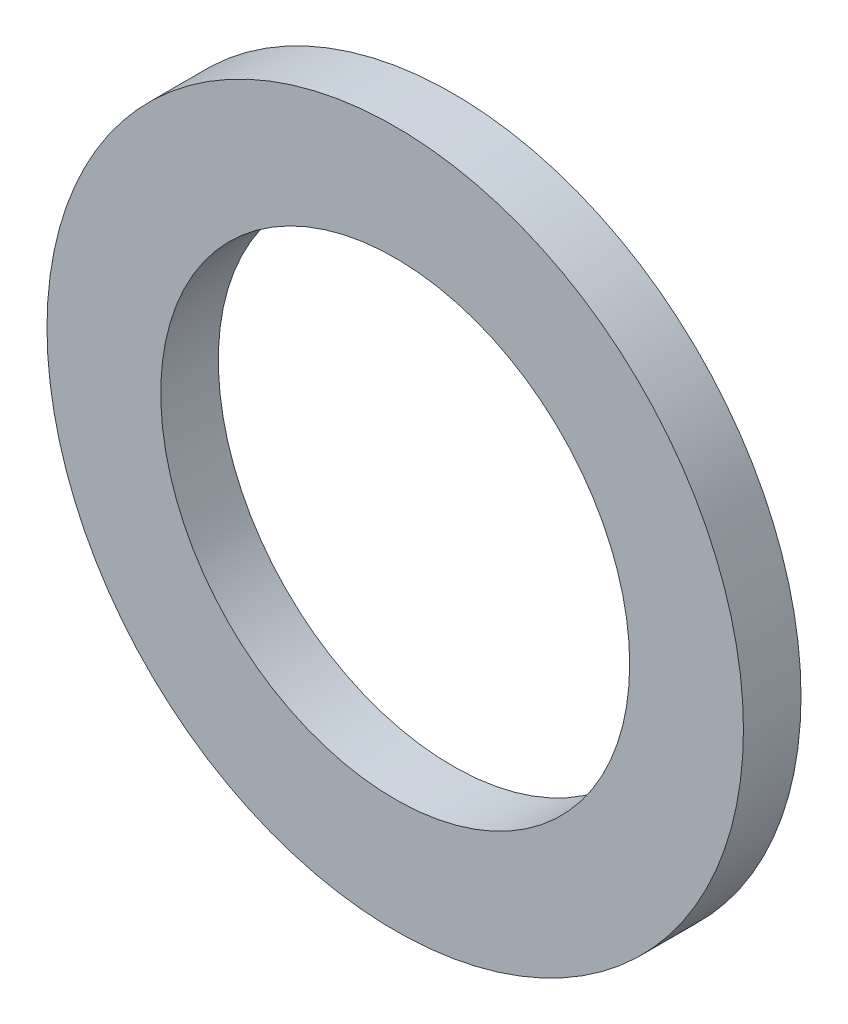
from build123d import *

# Parameters (mm, degrees)
SKETCH1_R           = 9.525
SKETCH1_R_2         = 6.4135
BOSS_EXTRUDE1_DEPTH = 1.5748


with BuildPart() as part:
    # Sketch1 → Boss-Extrude1 (new body)
    with BuildSketch(Plane.XY):
        Circle(SKETCH1_R)
        Circle(SKETCH1_R_2, mode=Mode.SUBTRACT)
    extrude(amount=BOSS_EXTRUDE1_DEPTH)


solid = part.part
